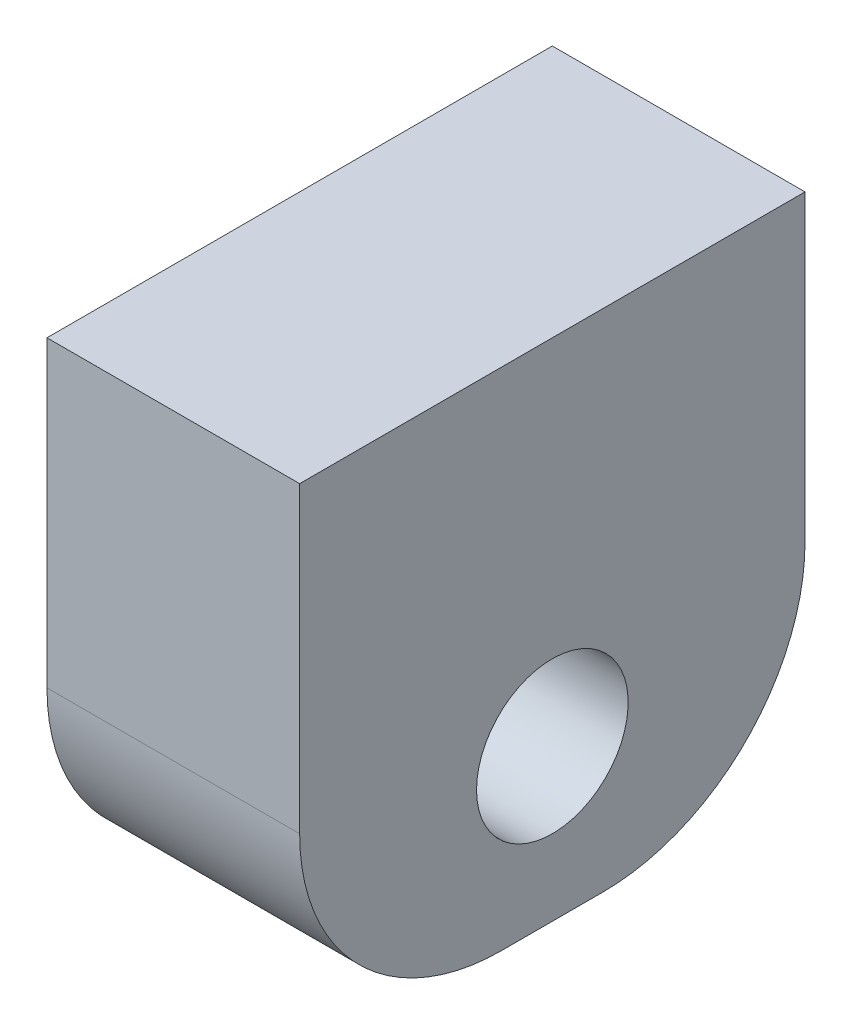
from build123d import *

# Parameters (mm, degrees)
SKETCH1_W           = 5
SKETCH1_H           = 10
BOSS_EXTRUDE1_DEPTH = 10
SKETCH2_R           = 1.5
CUT_EXTRUDE1_DEPTH  = 16
FILLET1_R           = 4


with BuildPart() as part:
    # Sketch1 → Boss-Extrude1 (new body)
    with BuildSketch(Plane.XY):
        with Locations((2.5, 5)):
            Rectangle(SKETCH1_W, SKETCH1_H)
    extrude(amount=BOSS_EXTRUDE1_DEPTH)

    # Sketch2 → Cut-Extrude1 (cut, through all)
    with BuildSketch(Plane.ZY):
        with Locations((5, 3)):
            Circle(SKETCH2_R)
    extrude(amount=-CUT_EXTRUDE1_DEPTH, mode=Mode.SUBTRACT)

    # Fillet1
    fillet1_edges = [part.edges().sort_by_distance(p)[0] for p in [
        (2.5, 0, 0),
        (2.5, 0, 10),
    ]]
    fillet(fillet1_edges, radius=FILLET1_R)


solid = part.part
